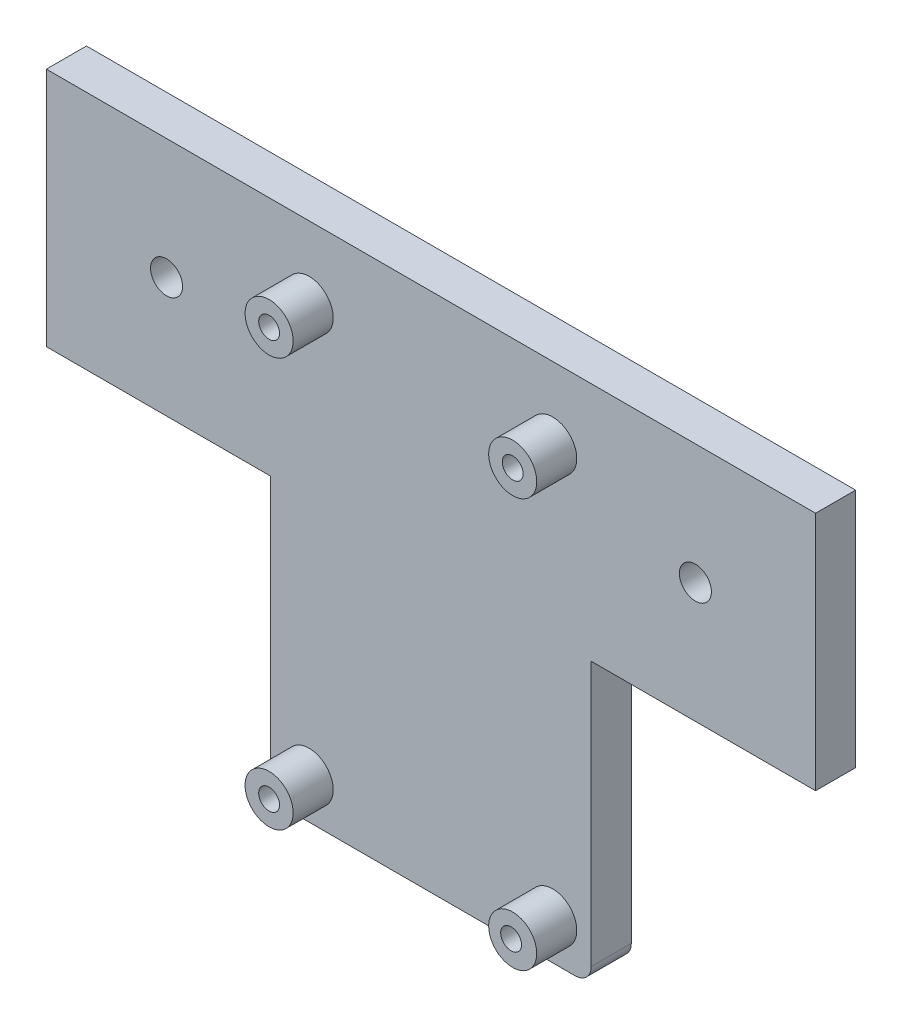
from build123d import *

# Parameters (mm, degrees)
SZKIC1_W                    = 96
SZKIC1_H                    = 30
DODANIE_WYCI_GNI_CIE1_DEPTH = 5
SZKIC2_W                    = 40
SZKIC2_H                    = 35
DODANIE_WYCI_GNI_CIE2_DEPTH = 5
SZKIC3_R                    = 2
WYTNIJ_WYCI_GNI_CIE1_DEPTH  = 5
SZKIC4_R                    = 3
DODANIE_WYCI_GNI_CIE3_DEPTH = 5
SZKIC5_R                    = 1.3
WYTNIJ_WYCI_GNI_CIE2_DEPTH  = 7
ZAOKR_GLENIE1_R             = 2


with BuildPart() as part:
    # Szkic1 → Dodanie-wyciągnięcie1 (new body)
    with BuildSketch(Plane.XY):
        with Locations((48, 15)):
            Rectangle(SZKIC1_W, SZKIC1_H)
    extrude(amount=DODANIE_WYCI_GNI_CIE1_DEPTH)

    # Szkic2 → Dodanie-wyciągnięcie2 (add)
    with BuildSketch(Plane.XY.offset(5)):
        with Locations((48, -17.5)):
            Rectangle(SZKIC2_W, SZKIC2_H)
    extrude(amount=-DODANIE_WYCI_GNI_CIE2_DEPTH)

    # Szkic3 → Wytnij-wyciągnięcie1 (cut)
    with BuildSketch(Plane.XY.offset(5)):
        with Locations((15, 15)):
            Circle(SZKIC3_R)
        with Locations((81, 15)):
            Circle(SZKIC3_R)
    extrude(amount=-WYTNIJ_WYCI_GNI_CIE1_DEPTH, mode=Mode.SUBTRACT)

    # Szkic4 → Dodanie-wyciągnięcie3 (add)
    with BuildSketch(Plane.XY.offset(5)):
        with Locations(Location((32.8, -30, 0), (0, 0, 180))):
            Circle(SZKIC4_R)
        with Locations(Location((63.2, -30, 0), (0, 0, 180))):
            Circle(SZKIC4_R)
        with Locations(Location((63.2, 21, 0), (0, 0, 180))):
            Circle(SZKIC4_R)
        with Locations(Location((32.8, 21, 0), (0, 0, 180))):
            Circle(SZKIC4_R)
    extrude(amount=DODANIE_WYCI_GNI_CIE3_DEPTH)

    # Szkic5 → Wytnij-wyciągnięcie2 (cut)
    with BuildSketch(Plane.XY.offset(10)):
        with Locations((32.8, 21)):
            Circle(SZKIC5_R)
        with Locations((63.2, 21)):
            Circle(SZKIC5_R)
        with Locations((32.8, -30)):
            Circle(SZKIC5_R)
        with Locations((63, -30)):
            Circle(SZKIC5_R)
    extrude(amount=-WYTNIJ_WYCI_GNI_CIE2_DEPTH, mode=Mode.SUBTRACT)

    # Zaokrąglenie1
    zaokr_glenie1_edges = [part.edges().sort_by_distance(p)[0] for p in [
        (28, -35, 2.5),
        (68, -35, 2.5),
    ]]
    fillet(zaokr_glenie1_edges, radius=ZAOKR_GLENIE1_R)


solid = part.part
